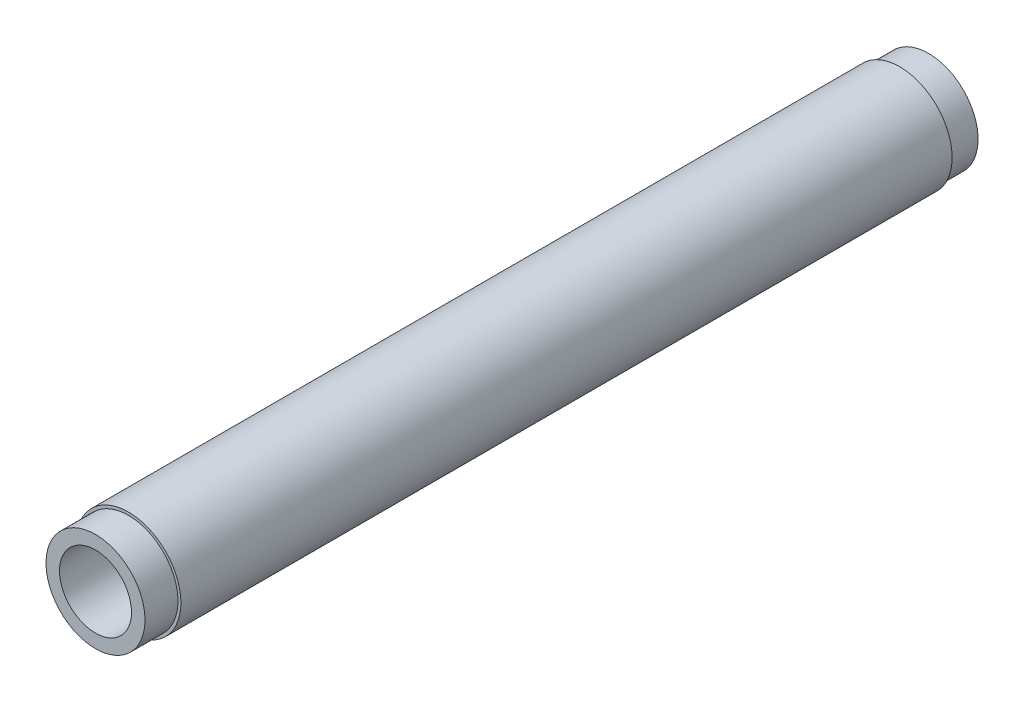
from build123d import *

# Parameters (mm, degrees)
EXTRUDE1_DEPTH          = 45
EXTRUDE1_DEPTH_BACK     = 56
SKETCH1_R               = 6
EXTRUDE2_DEPTH          = 41
EXTRUDE2_DEPTH_BACK     = 52.5
SKETCH2_R               = 6.35
CUT_EXTRUDE1_DEPTH      = 241.588362675
CUT_EXTRUDE1_DEPTH_BACK = 241.588362675
SKETCH3_R               = 4.365


with BuildPart() as part:
    # Sketch1 → Extrude1 (new, two sides: drawn at the far end of the back side and taken through both)
    with BuildSketch(Plane.XY.offset(-EXTRUDE1_DEPTH_BACK)):
        with Locations(Location((159.099025767, 159.099025767, 0), (0, 0, 180))):
            Circle(SKETCH1_R)
    extrude(amount=EXTRUDE1_DEPTH + EXTRUDE1_DEPTH_BACK)

    # Sketch2 → Extrude2 (add, two sides: drawn at the far end of the back side and taken through both)
    with BuildSketch(Plane.XY.offset(-EXTRUDE2_DEPTH_BACK)):
        with Locations(Location((159.099025767, 159.099025767, 0), (0, 0, 180))):
            Circle(SKETCH2_R)
    extrude(amount=EXTRUDE2_DEPTH + EXTRUDE2_DEPTH_BACK)

    # Sketch3 → Cut-Extrude1 (cut, two sides: drawn at the far end of the back side and taken through both)
    with BuildSketch(Plane.XY.offset(-CUT_EXTRUDE1_DEPTH_BACK)):
        with Locations((159.099025767, 159.099025767)):
            Circle(SKETCH3_R)
    extrude(amount=CUT_EXTRUDE1_DEPTH + CUT_EXTRUDE1_DEPTH_BACK, mode=Mode.SUBTRACT)


solid = part.part
